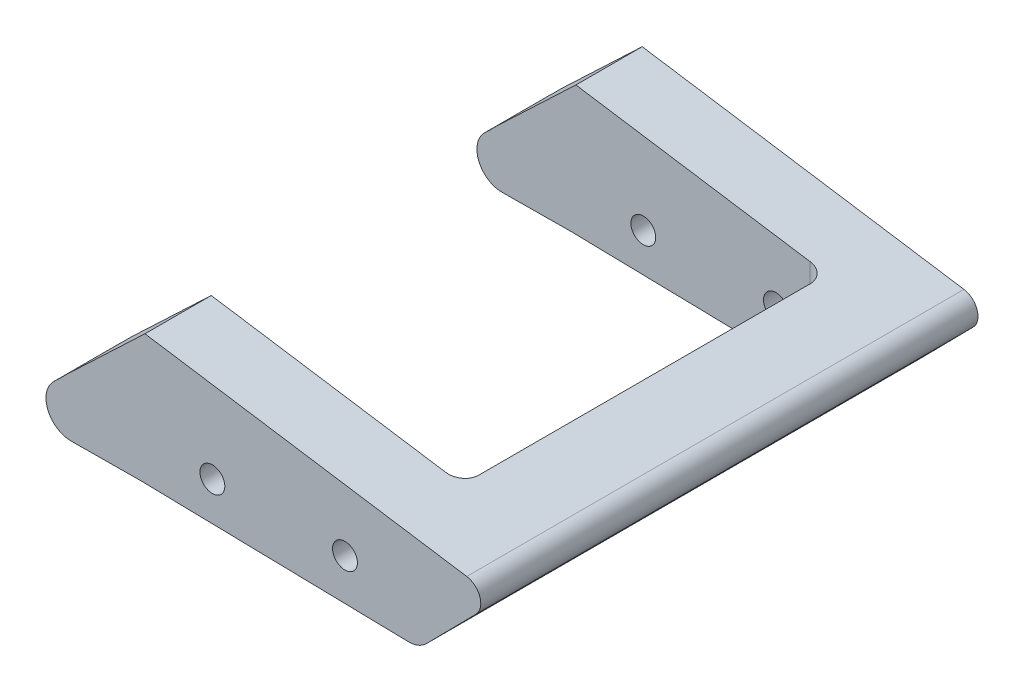
from build123d import *

# Parameters (mm, degrees)
SKETCH_1_W               = 25.57090008
SKETCH_1_H               = 8
SKETCH_1_R               = 1.5
EXTRUDE_1_DEPTH          = 60
SKETCH_2_W               = 25.57090008
SKETCH_2_H               = 8
EXTRUDE_2_DEPTH          = 60
SKETCH_3_W               = 28
SKETCH_3_H               = 44
CUT_EXTRUDE_1_DEPTH      = 69.0968921
FILLET_3_R               = 2
CUT_EXTRUDE_3_DEPTH      = 69.043275984
CUT_EXTRUDE_3_DEPTH_BACK = 69.043275984
SKETCH_5_W               = 19.965389019
SKETCH_5_H               = 10
SKETCH_5_W_2             = 8.378102734
SKETCH_5_W_3             = 2.578087264
SKETCH_5_W_4             = 4.306688818
FILLET_4_R               = 2
CUT_EXTRUDE_4_DEPTH      = 69.043275984
CUT_EXTRUDE_4_DEPTH_BACK = 69.043275984
SKETCH_6_W               = 44.193811727
SKETCH_6_H               = 36.690121775


with BuildPart() as part:
    # 草图1 → 凸台-拉伸1 (new body)
    with BuildSketch(Plane.XY):
        Rectangle(SKETCH_1_W, SKETCH_1_H)
        with Locations((-8, 0)):
            Circle(SKETCH_1_R, mode=Mode.SUBTRACT)
        with Locations(Location((8, 0, 0), (0, 0, 180))):
            Circle(SKETCH_1_R, mode=Mode.SUBTRACT)
    extrude(amount=EXTRUDE_1_DEPTH)

    # 草图2 → 凸台-拉伸2 (add)
    with BuildSketch(Plane(origin=(0, 0, 0), x_dir=(-1, 0, 0), z_dir=(0, 0, -1))):
        with BuildLine():
            Line((16.137009301, 11.124937293), (-26.558542517, 4.58378843))
            Line((-26.558542517, 4.58378843), (-17.833909304, -4.268253789))
            ThreePointArc((-17.833909304, -4.268253789), (-16.826188208, -4.941851182), (-15.634172765, -5.161702124))
            Line((-15.634172765, -5.161702124), (16.6770718, -4.481988152))
            Line((16.6770718, -4.481988152), (25.054954432, -4.542717367))
            ThreePointArc((25.054954432, -4.542717367), (27.868152877, -2.64179187), (27.105933567, 0.666776546))
            ThreePointArc((27.105933567, 0.666776546), (26.418024583, 1.322314845), (25.754738639, 2.002756605))
            Line((25.754738639, 2.002756605), (16.137009301, 11.124937293))
        make_face()
        Rectangle(SKETCH_2_W, SKETCH_2_H, mode=Mode.SUBTRACT)
    extrude(amount=-EXTRUDE_2_DEPTH)

    # 草图3 → 切除-拉伸1 (cut, through all)
    with BuildSketch(Plane(origin=(-0.101620306, -4.830676855, 0), x_dir=(0.9997788072376046, -0.02103179969837793, 0), z_dir=(-0.02103179969837793, -0.9997788072376046, 0))):
        with Locations((0, 30)):
            Rectangle(SKETCH_3_W, SKETCH_3_H)
    extrude(amount=-CUT_EXTRUDE_1_DEPTH, mode=Mode.SUBTRACT)

    # 圆角3
    fillet_3_edges = [part.edges().sort_by_distance(p)[0] for p in [
        (26.558542517, 4.58378843, 30),
    ]]
    fillet(fillet_3_edges, radius=FILLET_3_R)

    # 草图5 → 切除-拉伸3 (cut, two sides: drawn at the far end of the back side and taken through both)
    with BuildSketch(Plane(origin=(0.031610884, -4.360871013, 0), x_dir=(0.9999737288141071, 0.007248564106812576, 0), z_dir=(0.007248564106812577, -0.9999737288141072, 0)).offset(-CUT_EXTRUDE_3_DEPTH_BACK)):
        with Locations((-35.069918896, 47)):
            Rectangle(SKETCH_5_W, SKETCH_5_H)
        with Locations((-20.898173019, 47)):
            Rectangle(SKETCH_5_W_2, SKETCH_5_H)
        with Locations((-15.42007802, 47)):
            Rectangle(SKETCH_5_W_3, SKETCH_5_H)
        with Locations((-11.977689979, 47)):
            Rectangle(SKETCH_5_W_4, SKETCH_5_H)
    extrude(amount=CUT_EXTRUDE_3_DEPTH + CUT_EXTRUDE_3_DEPTH_BACK, mode=Mode.SUBTRACT)

    # 圆角4
    fillet_4_edges = [part.edges().sort_by_distance(p)[0] for p in [
        (14.017415967, 0.680655778, 52),
        (14.017415967, 0.680655778, 8),
        (-13.937599421, 3.113545967, 8),
    ]]
    fillet(fillet_4_edges, radius=FILLET_4_R)

    # 草图6 → 切除-拉伸4 (cut, two sides: drawn at the far end of the back side and taken through both)
    with BuildSketch(Plane(origin=(0.031610884, -4.360871013, 0), x_dir=(0.9999737288141071, 0.007248564106812576, 0), z_dir=(0.007248564106812577, -0.9999737288141072, 0)).offset(-CUT_EXTRUDE_4_DEPTH_BACK)):
        with Locations((-28.444987659, 26.345060888)):
            Rectangle(SKETCH_6_W, SKETCH_6_H)
    extrude(amount=CUT_EXTRUDE_4_DEPTH + CUT_EXTRUDE_4_DEPTH_BACK, mode=Mode.SUBTRACT)


solid = part.part
